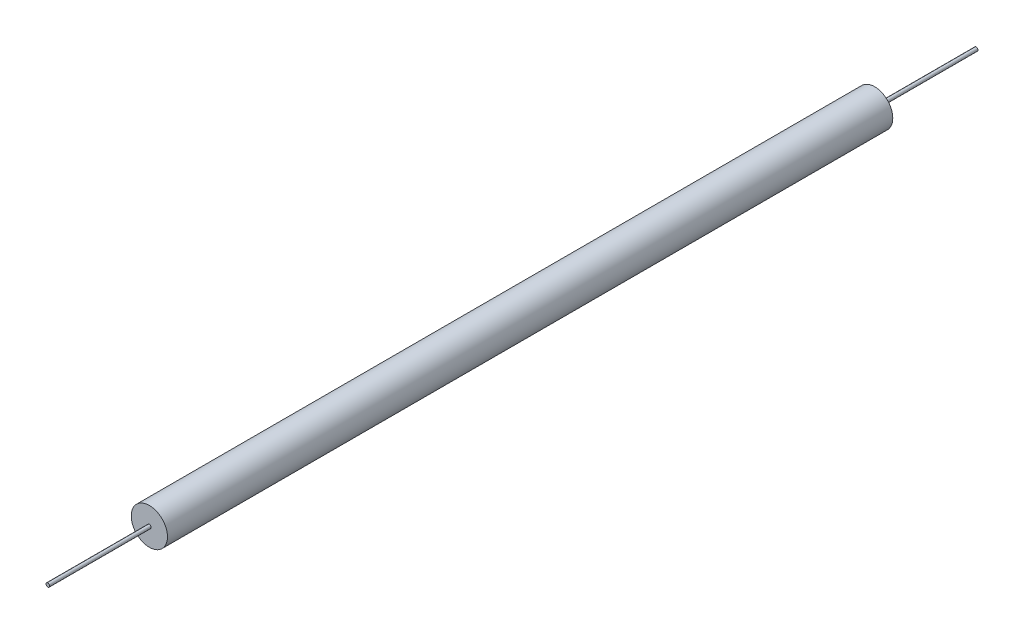
from build123d import *

# Parameters (mm, degrees)
SKETCH_7_R          = 5
EXTRUDE_4_DEPTH     = 200
SKETCH_8_R          = 0.5
EXTRUDE_5_DEPTH     = 28
EXTRUDE_START       = 84
SKETCH_9_R          = 0.5
EXTRUDE_6_DEPTH     = 84
SKETCH_10_R         = 0.5
CUT_EXTRUDE_1_DEPTH = 56


with BuildPart() as part:
    # 草图7 → 凸台-拉伸4 (new body)
    with BuildSketch(Plane.XY):
        Circle(SKETCH_7_R)
    extrude(amount=EXTRUDE_4_DEPTH)

    # 草图8 → 凸台-拉伸5 (add)
    with BuildSketch(Plane.XY.offset(200)):
        Circle(SKETCH_8_R)
    extrude(amount=EXTRUDE_5_DEPTH)

    # 草图9 → 凸台-拉伸6 (add)
    with BuildSketch(Plane(origin=(0, 0, 0), x_dir=(-1, 0, 0), z_dir=(0, 0, -1)).offset(EXTRUDE_START)):
        with Locations(Location((0, 0, 0), (0, 0, 180))):
            Circle(SKETCH_9_R)
    extrude(amount=-EXTRUDE_6_DEPTH)

    # 草图10 → 切除-拉伸1 (cut)
    with BuildSketch(Plane(origin=(0, 0, -84), x_dir=(-1, 0, 0), z_dir=(0, 0, -1))):
        with Locations(Location((0, 0, 0), (0, 0, 180))):
            Circle(SKETCH_10_R)
    extrude(amount=-CUT_EXTRUDE_1_DEPTH, mode=Mode.SUBTRACT)


solid = part.part
